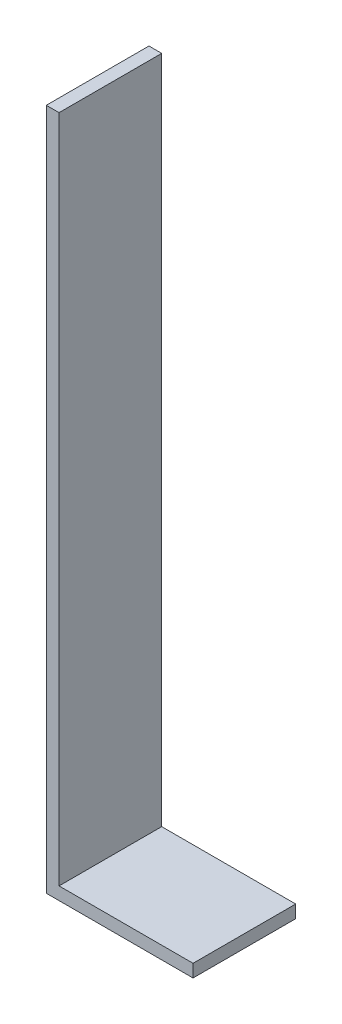
from build123d import *

# Parameters (mm, degrees)
SALIENTE_EXTRUIR1_DEPTH = 50.8


with BuildPart() as part:
    # Croquis1 → Saliente-Extruir1 (new body)
    with BuildSketch(Plane.XY):
        Polygon((0, 0), (72.62, 0), (72.62, 6.31), (6.31, 6.31), (6.31, 337.71), (0, 337.71), align=None)
    extrude(amount=SALIENTE_EXTRUIR1_DEPTH)


solid = part.part
